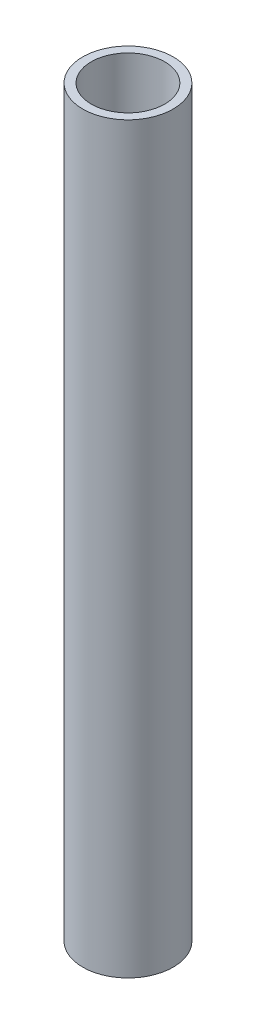
from build123d import *

# Parameters (mm, degrees)
SKETCH_1_R      = 10.65
SKETCH_1_R_2    = 8.65
EXTRUDE_1_DEPTH = 175


with BuildPart() as part:
    # Эскиз1 → Бобышка-Вытянуть1 (new body)
    with BuildSketch(Plane(origin=(0, 0, 0), x_dir=(1, 0, 0), z_dir=(0, 1, 0))):
        with Locations(Location((0, -1.5, 0), (0, 0, 270))):
            Circle(SKETCH_1_R)
        with Locations(Location((0, -1.5, 0), (0, 0, 270))):
            Circle(SKETCH_1_R_2, mode=Mode.SUBTRACT)
    extrude(amount=EXTRUDE_1_DEPTH)


solid = part.part
